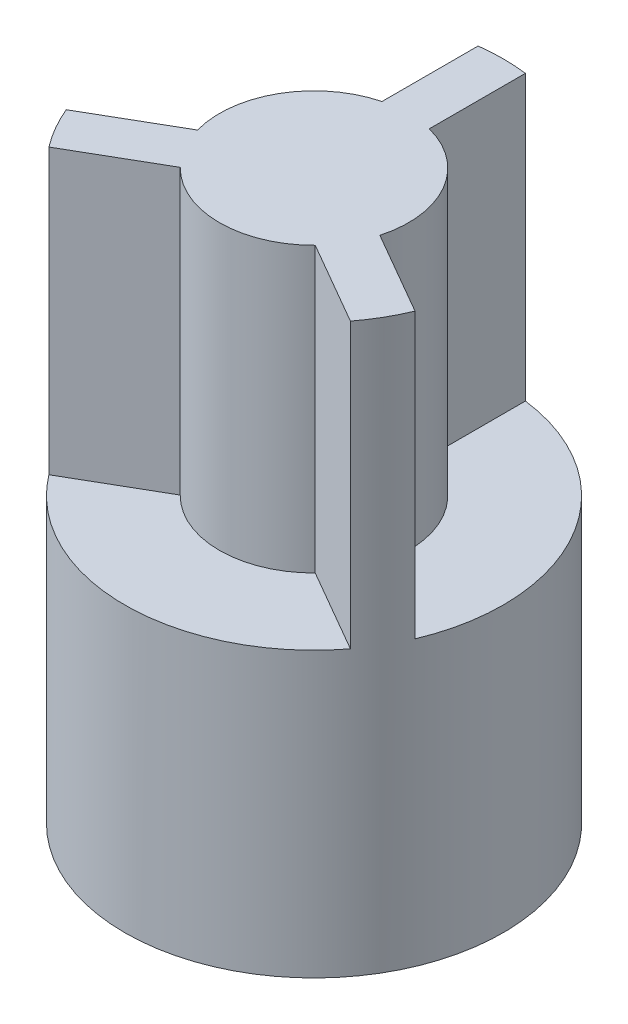
from build123d import *

# Parameters (mm, degrees)
SKETCH1_R           = 4
BOSS_EXTRUDE1_DEPTH = 6
SKETCH2_R           = 2
BOSS_EXTRUDE2_DEPTH = 6
BOSS_EXTRUDE3_DEPTH = 6


with BuildPart() as part:
    # Sketch1 → Boss-Extrude1 (new body)
    with BuildSketch(Plane(origin=(0, 0, 0), x_dir=(1, 0, 0), z_dir=(0, 1, 0))):
        with Locations(Location((0, 0, 0), (0, 0, 270))):
            Circle(SKETCH1_R)
    extrude(amount=BOSS_EXTRUDE1_DEPTH)

    # Sketch2 → Boss-Extrude2 (add)
    with BuildSketch(Plane(origin=(0, 6, 0), x_dir=(1, 0, 0), z_dir=(0, 1, 0))):
        with Locations(Location((0, 0, 0), (0, 0, 270))):
            Circle(SKETCH2_R)
    extrude(amount=BOSS_EXTRUDE2_DEPTH)

    # Sketch3 → Boss-Extrude3 (add)
    with BuildSketch(Plane(origin=(0, 6, 0), x_dir=(1, 0, 0), z_dir=(0, 1, 0))):
        with BuildLine():
            Line((-0.500000000000001, 3.968626966596886), (-0.5, 0.28867513459480454))
            Line((-0.5, 0.28867513459480454), (-3.6869317712168805, -1.551300781406223))
            ThreePointArc((-3.6869317712168805, -1.551300781406223), (-3.4641016151377557, -1.9999999999999982), (-3.186931771216881, -2.4173261851906616))
            Line((-3.186931771216881, -2.4173261851906616), (2.344e-14, -0.5773502691896194))
            Line((2.344e-14, -0.5773502691896194), (3.186931771216881, -2.4173261851906616))
            ThreePointArc((3.186931771216881, -2.4173261851906616), (3.4641016151377553, -1.9999999999999991), (3.6869317712168805, -1.551300781406223))
            Line((3.6869317712168805, -1.551300781406223), (0.5000000000000009, 0.28867513459480254))
            Line((0.5000000000000009, 0.28867513459480254), (0.49999999999999895, 3.968626966596886))
            ThreePointArc((0.49999999999999895, 3.968626966596886), (-1.53e-15, 4), (-0.500000000000001, 3.968626966596886))
        make_face()
    extrude(amount=BOSS_EXTRUDE3_DEPTH)


solid = part.part
